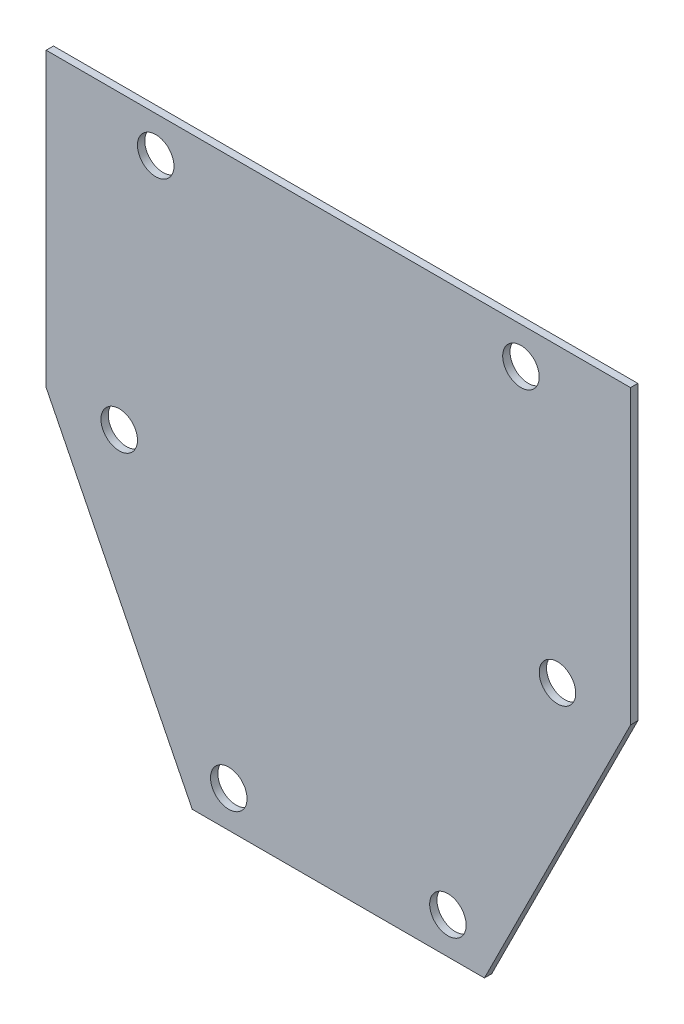
from build123d import *

# Parameters (mm, degrees)
SKETCH1_R           = 2.5
BOSS_EXTRUDE1_DEPTH = 0.5


with BuildPart() as part:
    # Sketch1 → Boss-Extrude1 (new, symmetric)
    # profile 1 of 2: a face of its own
    with BuildSketch(Plane.XY):
        Polygon((0, 40), (0, -40), (20, -40), (40, 0), (40, 40), align=None)
        with Locations((15, -35)):
            Circle(SKETCH1_R, mode=Mode.SUBTRACT)
        with Locations((30, 0)):
            Circle(SKETCH1_R, mode=Mode.SUBTRACT)
        with Locations((25, 35)):
            Circle(SKETCH1_R, mode=Mode.SUBTRACT)
    # profile 2 of 2: a face of its own
    with BuildSketch(Plane.XY):
        Polygon((-20, -40), (0, -40), (0, 40), (-40, 40), (-40, 0), align=None)
        with Locations((-15, -35)):
            Circle(SKETCH1_R, mode=Mode.SUBTRACT)
        with Locations((-30, 0)):
            Circle(SKETCH1_R, mode=Mode.SUBTRACT)
        with Locations((-25, 35)):
            Circle(SKETCH1_R, mode=Mode.SUBTRACT)
    extrude(amount=BOSS_EXTRUDE1_DEPTH, both=True)


solid = part.part
